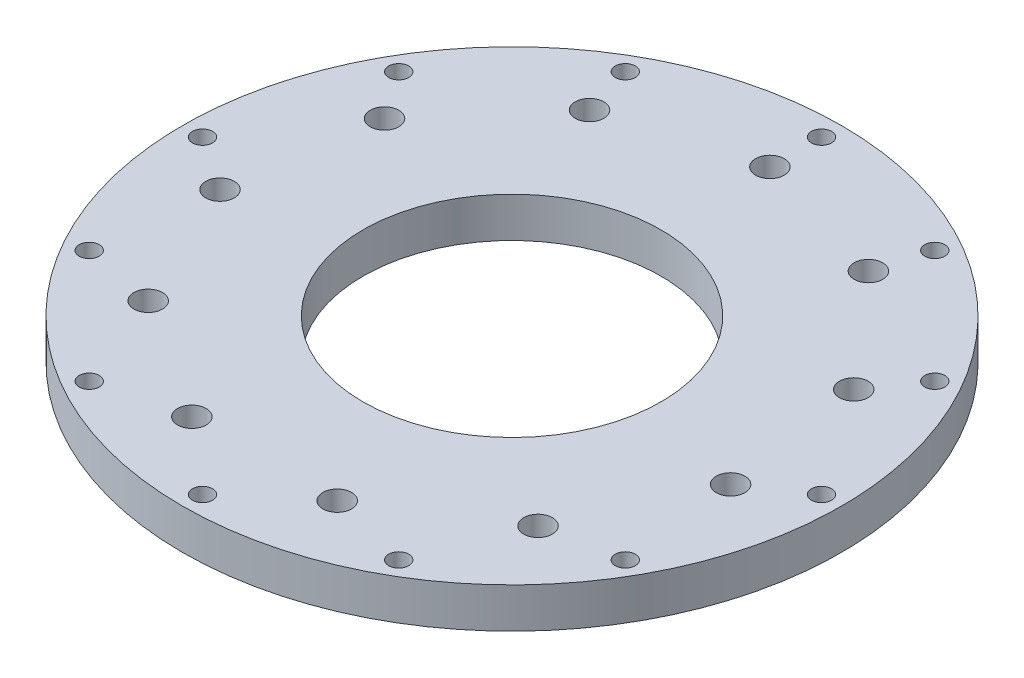
from build123d import *

# Parameters (mm, degrees)
SKETCH1_R           = 57.5
SKETCH1_R_2         = 1.75
SKETCH1_R_3         = 26
SKETCH1_R_4         = 2.5
BOSS_EXTRUDE1_DEPTH = 7


with BuildPart() as part:
    # Sketch1 → Boss-Extrude1 (new body)
    with BuildSketch(Plane(origin=(0, 0, 0), x_dir=(1, 0, 0), z_dir=(0, 1, 0))):
        with Locations(Location((0, 0, 0), (0, 0, 270))):
            Circle(SKETCH1_R)
        with Locations(Location((0, 54, 0), (0, 0, 270))):
            Circle(SKETCH1_R_2, mode=Mode.SUBTRACT)
        with Locations(Location((27, 46.765371804, 0), (0, 0, 270))):
            Circle(SKETCH1_R_2, mode=Mode.SUBTRACT)
        with Locations(Location((46.765371804, 27, 0), (0, 0, 270))):
            Circle(SKETCH1_R_2, mode=Mode.SUBTRACT)
        with Locations(Location((54, 0, 0), (0, 0, 270))):
            Circle(SKETCH1_R_2, mode=Mode.SUBTRACT)
        with Locations(Location((46.765371804, -27, 0), (0, 0, 270))):
            Circle(SKETCH1_R_2, mode=Mode.SUBTRACT)
        with Locations(Location((27, -46.765371804, 0), (0, 0, 270))):
            Circle(SKETCH1_R_2, mode=Mode.SUBTRACT)
        with Locations(Location((0, -54, 0), (0, 0, 270))):
            Circle(SKETCH1_R_2, mode=Mode.SUBTRACT)
        with Locations(Location((-27, -46.765371804, 0), (0, 0, 270))):
            Circle(SKETCH1_R_2, mode=Mode.SUBTRACT)
        with Locations(Location((-46.765371804, -27, 0), (0, 0, 270))):
            Circle(SKETCH1_R_2, mode=Mode.SUBTRACT)
        with Locations(Location((-54, 0, 0), (0, 0, 270))):
            Circle(SKETCH1_R_2, mode=Mode.SUBTRACT)
        with Locations(Location((-46.765371804, 27, 0), (0, 0, 270))):
            Circle(SKETCH1_R_2, mode=Mode.SUBTRACT)
        with Locations(Location((-27, 46.765371804, 0), (0, 0, 270))):
            Circle(SKETCH1_R_2, mode=Mode.SUBTRACT)
        with Locations(Location((0, 0, 0), (0, 0, 270))):
            Circle(SKETCH1_R_3, mode=Mode.SUBTRACT)
        with Locations(Location((0, 45, 0), (0, 0, 270))):
            Circle(SKETCH1_R_4, mode=Mode.SUBTRACT)
        with Locations(Location((24.328836786, 37.856408977, 0), (0, 0, 270))):
            Circle(SKETCH1_R_4, mode=Mode.SUBTRACT)
        with Locations(Location((40.933439791, 18.693675585, 0), (0, 0, 270))):
            Circle(SKETCH1_R_4, mode=Mode.SUBTRACT)
        with Locations(Location((44.541964885, -6.404167722, 0), (0, 0, 270))):
            Circle(SKETCH1_R_4, mode=Mode.SUBTRACT)
        with Locations(Location((34.008730846, -29.468733028, 0), (0, 0, 270))):
            Circle(SKETCH1_R_4, mode=Mode.SUBTRACT)
        with Locations(Location((12.677965058, -43.177183813, 0), (0, 0, 270))):
            Circle(SKETCH1_R_4, mode=Mode.SUBTRACT)
        with Locations(Location((-12.677965058, -43.177183813, 0), (0, 0, 270))):
            Circle(SKETCH1_R_4, mode=Mode.SUBTRACT)
        with Locations(Location((-34.008730846, -29.468733028, 0), (0, 0, 270))):
            Circle(SKETCH1_R_4, mode=Mode.SUBTRACT)
        with Locations(Location((-44.541964885, -6.404167722, 0), (0, 0, 270))):
            Circle(SKETCH1_R_4, mode=Mode.SUBTRACT)
        with Locations(Location((-40.933439791, 18.693675585, 0), (0, 0, 270))):
            Circle(SKETCH1_R_4, mode=Mode.SUBTRACT)
        with Locations(Location((-24.328836786, 37.856408977, 0), (0, 0, 270))):
            Circle(SKETCH1_R_4, mode=Mode.SUBTRACT)
    extrude(amount=BOSS_EXTRUDE1_DEPTH)


solid = part.part
